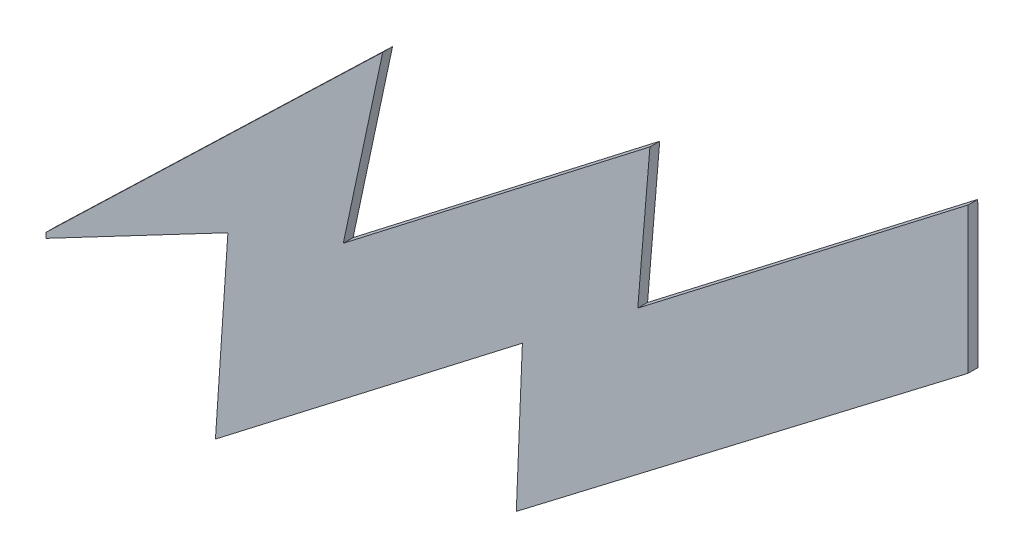
from build123d import *

# Parameters (mm, degrees)
BOSS_EXTRUDE1_DEPTH = 0.5


with BuildPart() as part:
    # Model → Boss-Extrude1 (new body)
    with BuildSketch(Plane.XY):
        Polygon((46.9862, 22.1658), (23.9632, 4.55783), (24.2725, 12.137), (8.63282, 0.0840929), (9.26867, 9.50792), (0, 4.62619), (0.0119358, 4.90343), (17.1571, 21.4182), (15.1465, 11.9824), (30.7693, 24.0474), (30.1503, 16.6228), (46.9732, 29.5833), align=None)
    extrude(amount=BOSS_EXTRUDE1_DEPTH)


solid = part.part
